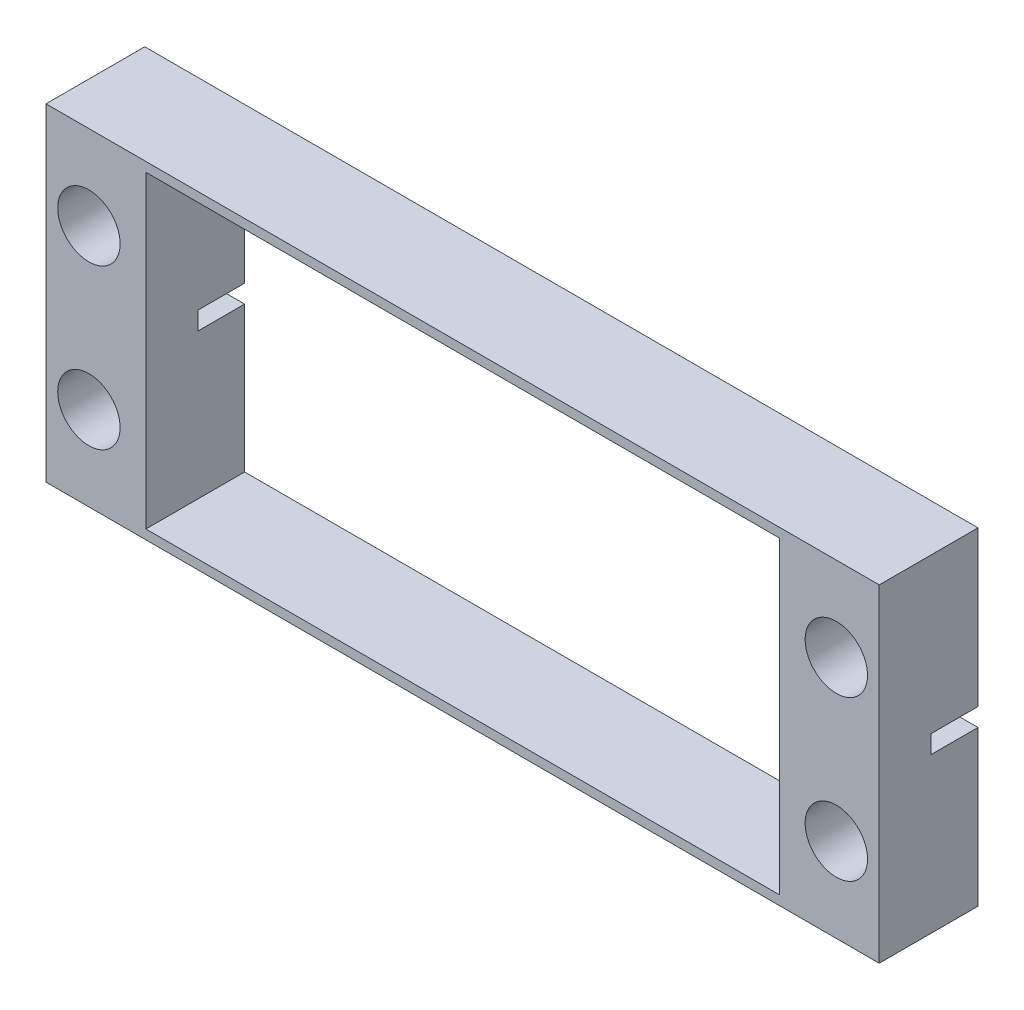
from build123d import *

# Parameters (mm, degrees)
SKETCH1_W           = 53.4
SKETCH1_H           = 21
BOSS_EXTRUDE2_DEPTH = 6.33000004
SKETCH3_W           = 40.6
SKETCH3_H           = 19.8
CUT_EXTRUDE1_DEPTH  = 30.380416956
SKETCH4_W           = 3
SKETCH4_H           = 1.16
CUT_EXTRUDE2_DEPTH  = 55.789405002
SKETCH5_R           = 2
CUT_EXTRUDE3_DEPTH  = 6.33


with BuildPart() as part:
    # Sketch1 → Boss-Extrude2 (new body)
    with BuildSketch(Plane.XY):
        Rectangle(SKETCH1_W, SKETCH1_H)
    extrude(amount=BOSS_EXTRUDE2_DEPTH)

    # Sketch3 → Cut-Extrude1 (cut, through all)
    with BuildSketch(Plane.XY.offset(6.33000004)):
        Rectangle(SKETCH3_W, SKETCH3_H)
    extrude(amount=-CUT_EXTRUDE1_DEPTH, mode=Mode.SUBTRACT)

    # Sketch4 → Cut-Extrude2 (cut, through all)
    with BuildSketch(Plane.ZY.offset(26.7)):
        with Locations((1.5, 0)):
            Rectangle(SKETCH4_W, SKETCH4_H)
    extrude(amount=-CUT_EXTRUDE2_DEPTH, mode=Mode.SUBTRACT)

    # Sketch5 → Cut-Extrude3 (cut)
    with BuildSketch(Plane.XY.offset(6.33000004)):
        with Locations((-23.95, 5.1)):
            Circle(SKETCH5_R)
        with Locations(Location((-23.95, -5.1, 0), (0, 0, 180))):
            Circle(SKETCH5_R)
        with Locations((23.95, -5.1)):
            Circle(SKETCH5_R)
        with Locations(Location((23.95, 5.1, 0), (0, 0, 180))):
            Circle(SKETCH5_R)
    extrude(amount=-CUT_EXTRUDE3_DEPTH, mode=Mode.SUBTRACT)


solid = part.part
